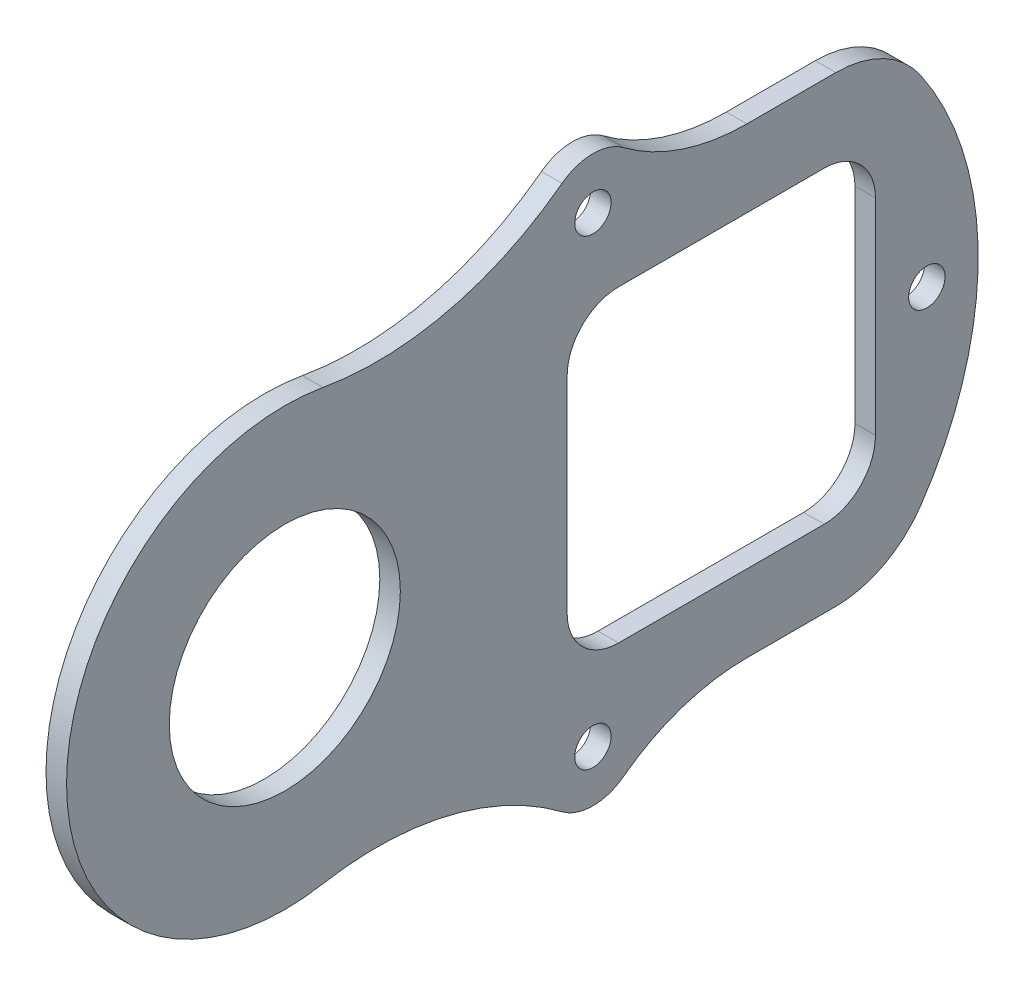
from build123d import *

# Parameters (mm, degrees)
SKETCH1_R             = 14.2875
BOSS_EXTRUDE1_DEPTH   = 2.54
F_8_CLEARANCE_HOLE1_D = 4.4958


with BuildPart() as part:
    # Sketch1 → Boss-Extrude1 (new body)
    with BuildSketch(Plane(origin=(0, 0, 0), x_dir=(0, 0, -1), z_dir=(1, 0, 0))):
        with BuildLine():
            Line((57.133054897, -28.5877), (68.132491023, -28.5877))
            ThreePointArc((68.132491023, -28.5877), (74.063897019, -27.117500662), (78.622019681, -23.04729416))
            ThreePointArc((78.622019681, -23.04729416), (85.7377, 0), (78.622019681, 23.04729416))
            ThreePointArc((78.622019681, 23.04729416), (74.063897019, 27.117500662), (68.132491023, 28.5877))
            Line((68.132491023, 28.5877), (57.133054897, 28.5877))
            ThreePointArc((57.133054897, 28.5877), (49.108905845, 29.888466983), (41.906610979, 33.65754))
            ThreePointArc((41.906610979, 33.65754), (38.092212748, 34.924995225), (34.280934646, 33.648188329))
            ThreePointArc((34.280934646, 33.648188329), (20.233265061, 27.033421998), (4.712956656, 26.572790516))
            ThreePointArc((4.712956656, 26.572790516), (-26.9875, 0), (4.712956656, -26.572790516))
            ThreePointArc((4.712956656, -26.572790516), (20.233265061, -27.033421998), (34.280934646, -33.648188329))
            ThreePointArc((34.280934646, -33.648188329), (38.092212748, -34.924995225), (41.906610979, -33.65754))
            ThreePointArc((41.906610979, -33.65754), (49.108905845, -29.888466983), (57.133054897, -28.5877))
        make_face()
        Circle(SKETCH1_R, mode=Mode.SUBTRACT)
        with BuildLine():
            Line((41.2623, 19.0627), (66.6877, 19.0627))
            ThreePointArc((66.6877, 19.0627), (71.177828061, 17.202828061), (73.0377, 12.7127))
            Line((73.0377, 12.7127), (73.0377, -12.7127))
            ThreePointArc((73.0377, -12.7127), (71.177828061, -17.202828061), (66.6877, -19.0627))
            Line((66.6877, -19.0627), (41.2623, -19.0627))
            ThreePointArc((41.2623, -19.0627), (36.772171939, -17.202828061), (34.9123, -12.7127))
            Line((34.9123, -12.7127), (34.9123, 12.7127))
            ThreePointArc((34.9123, 12.7127), (36.772171939, 17.202828061), (41.2623, 19.0627))
        make_face(mode=Mode.SUBTRACT)
    extrude(amount=BOSS_EXTRUDE1_DEPTH)

    # #8 Clearance Hole1 (through all)
    with Locations(Plane(origin=(2.54, 0, 0), x_dir=(0, 0, -1), z_dir=(1, 0, 0))):
        with Locations((38.1, 28.575), (79.3877, 0), (38.1, -28.575)):
            Hole(F_8_CLEARANCE_HOLE1_D / 2)


solid = part.part
